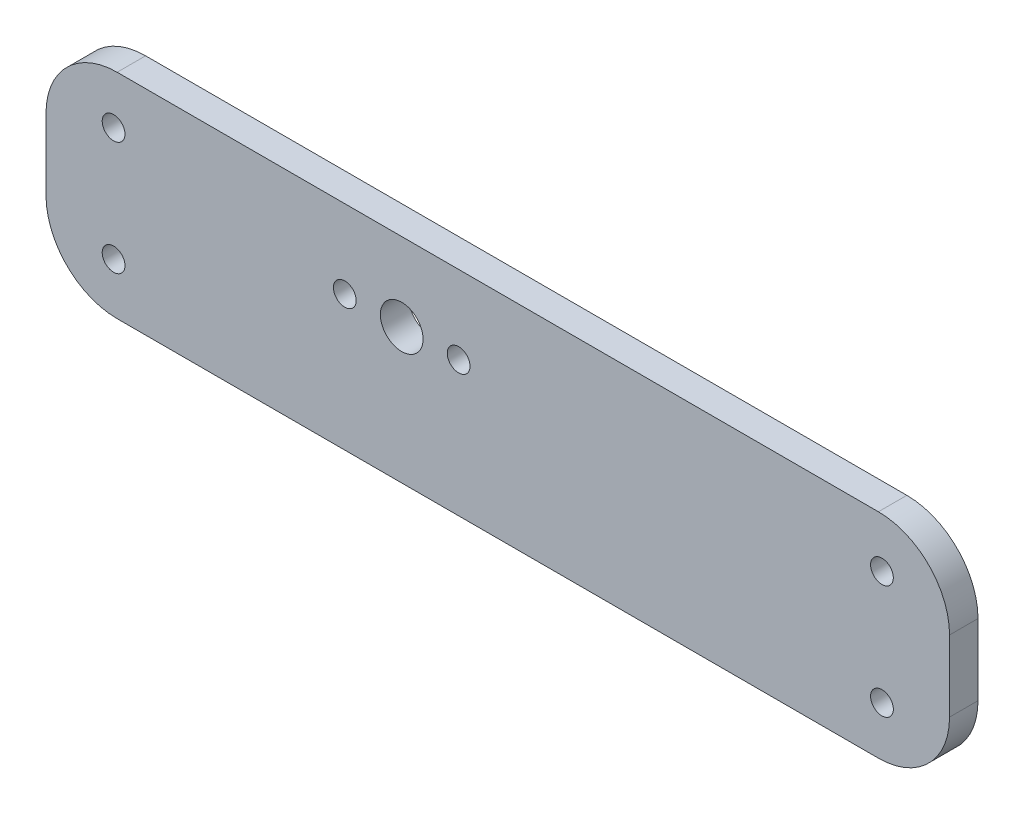
from build123d import *

# Parameters (mm, degrees)
ESBO_O1_W                = 127
ESBO_O1_H                = 30
ESBO_O1_R                = 3
ESBO_O1_R_2              = 1.6
RESSALTO_EXTRUS_O1_DEPTH = 4
FILETE1_R                = 10


with BuildPart() as part:
    # Esboço1 → Ressalto-extrusão1 (new body)
    with BuildSketch(Plane.XY):
        Rectangle(ESBO_O1_W, ESBO_O1_H)
        with Locations((-13.5, 4)):
            Circle(ESBO_O1_R, mode=Mode.SUBTRACT)
        with Locations((-5.5, 4)):
            Circle(ESBO_O1_R_2, mode=Mode.SUBTRACT)
        with Locations((-21.5, 4)):
            Circle(ESBO_O1_R_2, mode=Mode.SUBTRACT)
        with Locations((-54, 8)):
            Circle(ESBO_O1_R_2, mode=Mode.SUBTRACT)
        with Locations(Location((-54, -8, 0), (0, 0, 180))):
            Circle(ESBO_O1_R_2, mode=Mode.SUBTRACT)
        with Locations((54, -8)):
            Circle(ESBO_O1_R_2, mode=Mode.SUBTRACT)
        with Locations(Location((54, 8, 0), (0, 0, 180))):
            Circle(ESBO_O1_R_2, mode=Mode.SUBTRACT)
    extrude(amount=RESSALTO_EXTRUS_O1_DEPTH)

    # Filete1
    filete1_edges = [part.edges().sort_by_distance(p)[0] for p in [
        (63.5, -15, 2),
        (-63.5, -15, 2),
        (-63.5, 15, 2),
        (63.5, 15, 2),
    ]]
    fillet(filete1_edges, radius=FILETE1_R)


solid = part.part
